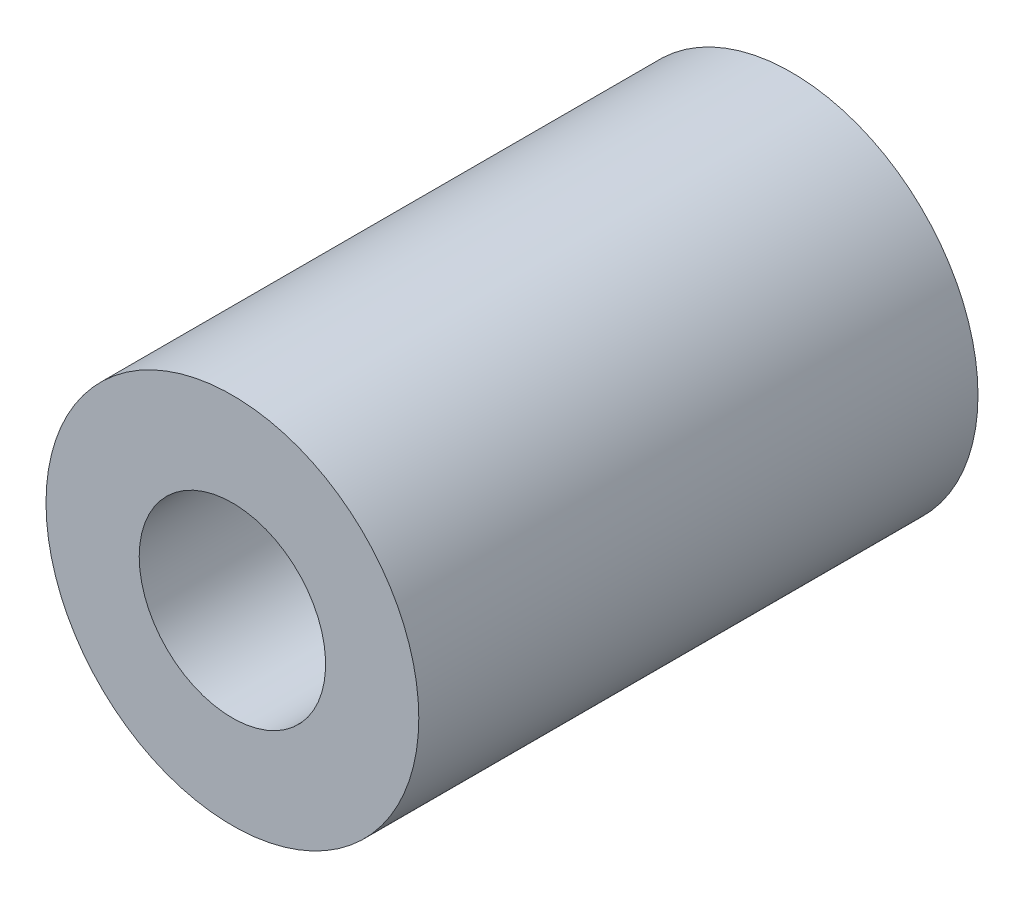
from build123d import *

# Parameters (mm, degrees)
SKETCH1_R           = 12.7
SKETCH1_R_2         = 6.35
BOSS_EXTRUDE1_DEPTH = 38.1


with BuildPart() as part:
    # Sketch1 → Boss-Extrude1 (new body)
    with BuildSketch(Plane.XY):
        with Locations(Location((-20.639436088, 21.595703397, 0), (0, 0, 180))):
            Circle(SKETCH1_R)
        with Locations(Location((-20.639436088, 21.595703397, 0), (0, 0, 180))):
            Circle(SKETCH1_R_2, mode=Mode.SUBTRACT)
    extrude(amount=BOSS_EXTRUDE1_DEPTH)


solid = part.part
